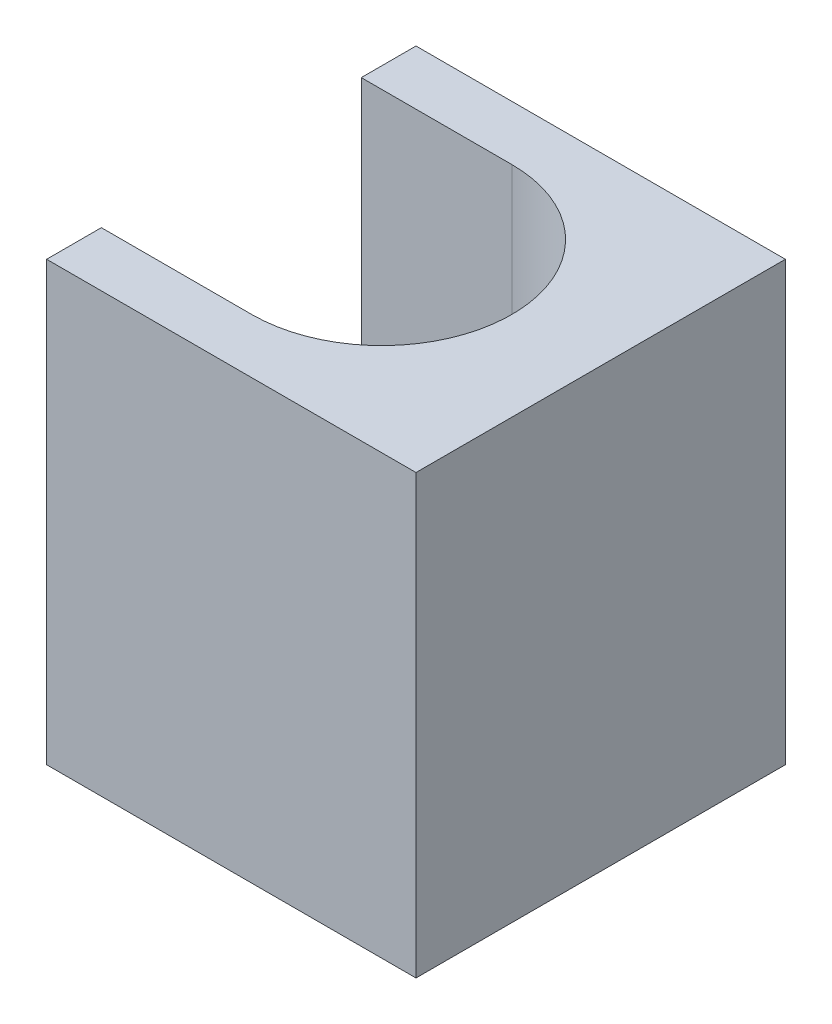
from build123d import *

# Parameters (mm, degrees)
SKETCH_1_R          = 3.5
EXTRUDE_2_DEPTH     = 16
CUT_EXTRUDE_START   = 2
SKETCH_1_7_W        = 11.5
SKETCH_1_7_H        = 9.5
SKETCH_1_7_R        = 3.5
CUT_EXTRUDE_6_DEPTH = 4
SKETCH_1_9_R        = 3.5
CUT_EXTRUDE_8_DEPTH = 14


with BuildPart() as part:
    # 草图1 → 凸台-拉伸2 (new body)
    # profile 1 of 3: a face of its own
    with BuildSketch(Plane(origin=(0, 0, 0), x_dir=(1, 0, 0), z_dir=(0, 1, 0))):
        Polygon((0, 9.5), (0, 11.5), (5.5, 11.5), (13.5, 11.5), (13.5, -2), (5.5, -2), (0, -2), (0, 0), (5.5, 0), (11.5, 0), (11.5, 9.5), (5.5, 9.5), align=None)
    # profile 2 of 3: a face of its own
    with BuildSketch(Plane(origin=(0, 0, 0), x_dir=(1, 0, 0), z_dir=(0, 1, 0))):
        with BuildLine():
            Line((5.5, 9.5), (11.5, 9.5))
            Line((11.5, 9.5), (11.5, 0))
            Line((11.5, 0), (5.5, 0))
            ThreePointArc((5.5, 0), (10.25, 4.75), (5.5, 9.5))
        make_face()
    # profile 3 of 3: a face of its own
    with BuildSketch(Plane(origin=(0, 0, 0), x_dir=(1, 0, 0), z_dir=(0, 1, 0))):
        with BuildLine():
            ThreePointArc((5.5, 9.5), (10.25, 4.75), (5.5, 0))
            Line((5.5, 0), (0, 0))
            Line((0, 0), (0, 9.5))
            Line((0, 9.5), (5.5, 9.5))
        make_face()
        with Locations((5.5, 4.75)):
            Circle(SKETCH_1_R, mode=Mode.SUBTRACT)
    extrude(amount=EXTRUDE_2_DEPTH)

    # 草图1<7> → 切除-拉伸6 (cut)
    with BuildSketch(Plane(origin=(0, 0, 0), x_dir=(1, 0, 0), z_dir=(0, 1, 0)).offset(CUT_EXTRUDE_START)):
        with Locations((5.75, 4.75)):
            Rectangle(SKETCH_1_7_W, SKETCH_1_7_H)
        with Locations((5.5, 4.75)):
            Circle(SKETCH_1_7_R, mode=Mode.SUBTRACT)
    extrude(amount=CUT_EXTRUDE_6_DEPTH, mode=Mode.SUBTRACT)

    # 草图1<9> → 切除-拉伸8 (cut)
    with BuildSketch(Plane(origin=(0, 0, 0), x_dir=(1, 0, 0), z_dir=(0, 1, 0)).offset(CUT_EXTRUDE_START)):
        with BuildLine():
            Line((0, 9.5), (0, 0))
            Line((0, 0), (5.5, 0))
            ThreePointArc((5.5, 0), (10.25, 4.75), (5.5, 9.5))
            Line((5.5, 9.5), (0, 9.5))
        make_face()
        with Locations((5.5, 4.75)):
            Circle(SKETCH_1_9_R, mode=Mode.SUBTRACT)
    extrude(amount=CUT_EXTRUDE_8_DEPTH, mode=Mode.SUBTRACT)


solid = part.part
